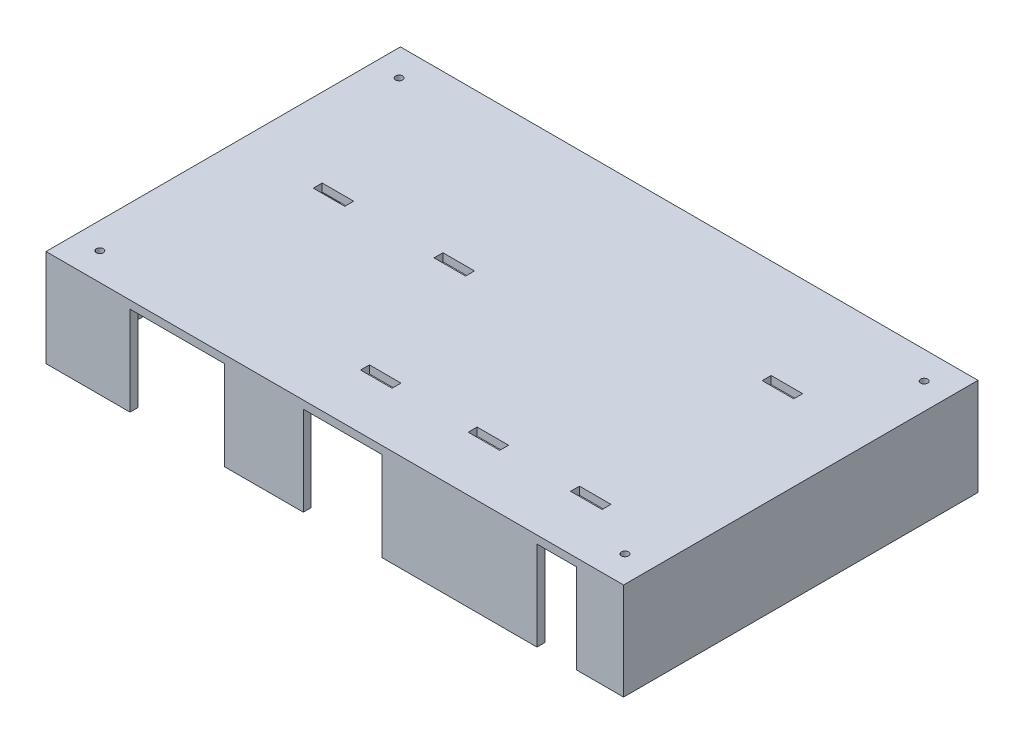
from build123d import *

# Parameters (mm, degrees)
SKETCH_1_W                     = 220
SKETCH_1_H                     = 135
BASE_FLOOR_3MM_DEPTH           = 3
SKETCH_2_W                     = 220
SKETCH_2_H                     = 3
BACK_WALL_DEPTH                = 37
SKETCH_3_W                     = 3
SKETCH_3_H                     = 132
LEFT_WALL_DEPTH                = 37
SKETCH_4_W                     = 3
SKETCH_4_H                     = 132
RIGHT_WALL_DEPTH               = 37
SKETCH_5_W                     = 32
SKETCH_5_H                     = 3
FRONT_LEFT_WALL_DEPTH          = 37
SKETCH_6_W                     = 30
SKETCH_6_H                     = 3
FRONT_CAMERA_BRIDGE_DEPTH      = 37
SKETCH_7_W                     = 59
SKETCH_7_H                     = 3
FRONT_SR04_BRIDGE_DEPTH        = 37
SKETCH_8_W                     = 18
SKETCH_8_H                     = 3
FRONT_RIGHT_WALL_DEPTH         = 37
SKETCH_9_R                     = 5
LID_BOSS_1_DEPTH               = 30
SKETCH_10_R                    = 1.35
LID_BOSS_1_PILOT_DEPTH         = 34
SKETCH_11_R                    = 5
LID_BOSS_2_DEPTH               = 30
SKETCH_12_R                    = 1.35
LID_BOSS_2_PILOT_DEPTH         = 34
SKETCH_13_R                    = 5
LID_BOSS_3_DEPTH               = 30
SKETCH_14_R                    = 1.35
LID_BOSS_3_PILOT_DEPTH         = 34
SKETCH_15_R                    = 5
LID_BOSS_4_DEPTH               = 30
SKETCH_16_R                    = 1.35
LID_BOSS_4_PILOT_DEPTH         = 34
SKETCH_17_R                    = 1.6
P4_NANO_PEG_1_DEPTH            = 7
SKETCH_18_R                    = 1.6
P4_NANO_PEG_2_DEPTH            = 7
SKETCH_19_R                    = 1.6
P4_NANO_PEG_3_DEPTH            = 7
SKETCH_20_R                    = 1.6
P4_NANO_PEG_4_DEPTH            = 7
SKETCH_21_R                    = 1.6
MEGA_PEG_1_DEPTH               = 7
SKETCH_22_R                    = 1.6
MEGA_PEG_2_DEPTH               = 7
SKETCH_23_R                    = 1.6
MEGA_PEG_3_DEPTH               = 7
SKETCH_24_R                    = 1.6
MEGA_PEG_4_DEPTH               = 7
SKETCH_25_W                    = 12
SKETCH_25_H                    = 3.4
CABLE_TIE_SLOT_1_DEPTH         = 4
SKETCH_26_W                    = 12
SKETCH_26_H                    = 3.4
CABLE_TIE_SLOT_2_DEPTH         = 4
SKETCH_27_W                    = 12
SKETCH_27_H                    = 3.4
CABLE_TIE_SLOT_3_DEPTH         = 4
SKETCH_28_W                    = 12
SKETCH_28_H                    = 3.4
CABLE_TIE_SLOT_4_DEPTH         = 4
SKETCH_29_W                    = 12
SKETCH_29_H                    = 3.4
CABLE_TIE_SLOT_5_DEPTH         = 4
SKETCH_30_W                    = 12
SKETCH_30_H                    = 3.4
CABLE_TIE_SLOT_6_DEPTH         = 4
SKETCH_31_W                    = 67
SKETCH_31_H                    = 3
ADJUSTABLE_SENSOR_RAIL_1_DEPTH = 4
SKETCH_32_W                    = 67
SKETCH_32_H                    = 3
ADJUSTABLE_SENSOR_RAIL_2_DEPTH = 4


with BuildPart() as part:
    # 草图1 → Base_Floor_3mm (new body)
    with BuildSketch(Plane(origin=(0, 0, 0), x_dir=(1, 0, 0), z_dir=(0, 1, 0))):
        Rectangle(SKETCH_1_W, SKETCH_1_H)
    extrude(amount=-BASE_FLOOR_3MM_DEPTH)

    # 草图2 → Back_Wall (add)
    with BuildSketch(Plane(origin=(0, 0, 0), x_dir=(1, 0, 0), z_dir=(0, 1, 0))):
        with Locations((0, 66)):
            Rectangle(SKETCH_2_W, SKETCH_2_H)
    extrude(amount=-BACK_WALL_DEPTH)

    # 草图3 → Left_Wall (add)
    with BuildSketch(Plane(origin=(0, 0, 0), x_dir=(1, 0, 0), z_dir=(0, 1, 0))):
        with Locations((-108.5, -1.5)):
            Rectangle(SKETCH_3_W, SKETCH_3_H)
    extrude(amount=-LEFT_WALL_DEPTH)

    # 草图4 → Right_Wall (add)
    with BuildSketch(Plane(origin=(0, 0, 0), x_dir=(1, 0, 0), z_dir=(0, 1, 0))):
        with Locations((108.5, -1.5)):
            Rectangle(SKETCH_4_W, SKETCH_4_H)
    extrude(amount=-RIGHT_WALL_DEPTH)

    # 草图5 → Front_Left_Wall (add)
    with BuildSketch(Plane(origin=(0, 0, 0), x_dir=(1, 0, 0), z_dir=(0, 1, 0))):
        with Locations((-94, -66)):
            Rectangle(SKETCH_5_W, SKETCH_5_H)
    extrude(amount=-FRONT_LEFT_WALL_DEPTH)

    # 草图6 → Front_Camera_Bridge (add)
    with BuildSketch(Plane(origin=(0, 0, 0), x_dir=(1, 0, 0), z_dir=(0, 1, 0))):
        with Locations((-27, -66)):
            Rectangle(SKETCH_6_W, SKETCH_6_H)
    extrude(amount=-FRONT_CAMERA_BRIDGE_DEPTH)

    # 草图7 → Front_SR04_Bridge (add)
    with BuildSketch(Plane(origin=(0, 0, 0), x_dir=(1, 0, 0), z_dir=(0, 1, 0))):
        with Locations((47.5, -66)):
            Rectangle(SKETCH_7_W, SKETCH_7_H)
    extrude(amount=-FRONT_SR04_BRIDGE_DEPTH)

    # 草图8 → Front_Right_Wall (add)
    with BuildSketch(Plane(origin=(0, 0, 0), x_dir=(1, 0, 0), z_dir=(0, 1, 0))):
        with Locations((101, -66)):
            Rectangle(SKETCH_8_W, SKETCH_8_H)
    extrude(amount=-FRONT_RIGHT_WALL_DEPTH)

    # 草图9 → Lid_Boss_1 (add)
    with BuildSketch(Plane(origin=(0, 0, 0), x_dir=(1, 0, 0), z_dir=(0, 1, 0))):
        with Locations(Location((-100, -57, 0), (0, 0, 270))):
            Circle(SKETCH_9_R)
    extrude(amount=-LID_BOSS_1_DEPTH)

    # 草图10 → Lid_Boss_1_Pilot (cut)
    with BuildSketch(Plane(origin=(0, 0, 0), x_dir=(1, 0, 0), z_dir=(0, 1, 0))):
        with Locations(Location((-100, -57, 0), (0, 0, 270))):
            Circle(SKETCH_10_R)
    extrude(amount=-LID_BOSS_1_PILOT_DEPTH, mode=Mode.SUBTRACT)

    # 草图11 → Lid_Boss_2 (add)
    with BuildSketch(Plane(origin=(0, 0, 0), x_dir=(1, 0, 0), z_dir=(0, 1, 0))):
        with Locations(Location((100, -57, 0), (0, 0, 270))):
            Circle(SKETCH_11_R)
    extrude(amount=-LID_BOSS_2_DEPTH)

    # 草图12 → Lid_Boss_2_Pilot (cut)
    with BuildSketch(Plane(origin=(0, 0, 0), x_dir=(1, 0, 0), z_dir=(0, 1, 0))):
        with Locations(Location((100, -57, 0), (0, 0, 270))):
            Circle(SKETCH_12_R)
    extrude(amount=-LID_BOSS_2_PILOT_DEPTH, mode=Mode.SUBTRACT)

    # 草图13 → Lid_Boss_3 (add)
    with BuildSketch(Plane(origin=(0, 0, 0), x_dir=(1, 0, 0), z_dir=(0, 1, 0))):
        with Locations(Location((-100, 57, 0), (0, 0, 270))):
            Circle(SKETCH_13_R)
    extrude(amount=-LID_BOSS_3_DEPTH)

    # 草图14 → Lid_Boss_3_Pilot (cut)
    with BuildSketch(Plane(origin=(0, 0, 0), x_dir=(1, 0, 0), z_dir=(0, 1, 0))):
        with Locations(Location((-100, 57, 0), (0, 0, 270))):
            Circle(SKETCH_14_R)
    extrude(amount=-LID_BOSS_3_PILOT_DEPTH, mode=Mode.SUBTRACT)

    # 草图15 → Lid_Boss_4 (add)
    with BuildSketch(Plane(origin=(0, 0, 0), x_dir=(1, 0, 0), z_dir=(0, 1, 0))):
        with Locations(Location((100, 57, 0), (0, 0, 270))):
            Circle(SKETCH_15_R)
    extrude(amount=-LID_BOSS_4_DEPTH)

    # 草图16 → Lid_Boss_4_Pilot (cut)
    with BuildSketch(Plane(origin=(0, 0, 0), x_dir=(1, 0, 0), z_dir=(0, 1, 0))):
        with Locations(Location((100, 57, 0), (0, 0, 270))):
            Circle(SKETCH_16_R)
    extrude(amount=-LID_BOSS_4_PILOT_DEPTH, mode=Mode.SUBTRACT)

    # 草图17 → P4_NANO_Peg_1 (add)
    with BuildSketch(Plane(origin=(0, 0, 0), x_dir=(1, 0, 0), z_dir=(0, 1, 0))):
        with Locations(Location((-93, 18, 0), (0, 0, 270))):
            Circle(SKETCH_17_R)
    extrude(amount=-P4_NANO_PEG_1_DEPTH)

    # 草图18 → P4_NANO_Peg_2 (add)
    with BuildSketch(Plane(origin=(0, 0, 0), x_dir=(1, 0, 0), z_dir=(0, 1, 0))):
        with Locations(Location((-48, 18, 0), (0, 0, 270))):
            Circle(SKETCH_18_R)
    extrude(amount=-P4_NANO_PEG_2_DEPTH)

    # 草图19 → P4_NANO_Peg_3 (add)
    with BuildSketch(Plane(origin=(0, 0, 0), x_dir=(1, 0, 0), z_dir=(0, 1, 0))):
        with Locations((-93, 63)):
            Circle(SKETCH_19_R)
    extrude(amount=-P4_NANO_PEG_3_DEPTH)

    # 草图20 → P4_NANO_Peg_4 (add)
    with BuildSketch(Plane(origin=(0, 0, 0), x_dir=(1, 0, 0), z_dir=(0, 1, 0))):
        with Locations((-48, 63)):
            Circle(SKETCH_20_R)
    extrude(amount=-P4_NANO_PEG_4_DEPTH)

    # 草图21 → Mega_Peg_1 (add)
    with BuildSketch(Plane(origin=(0, 0, 0), x_dir=(1, 0, 0), z_dir=(0, 1, 0))):
        with Locations(Location((0, -30, 0), (0, 0, 270))):
            Circle(SKETCH_21_R)
    extrude(amount=-MEGA_PEG_1_DEPTH)

    # 草图22 → Mega_Peg_2 (add)
    with BuildSketch(Plane(origin=(0, 0, 0), x_dir=(1, 0, 0), z_dir=(0, 1, 0))):
        with Locations(Location((96, -30, 0), (0, 0, 270))):
            Circle(SKETCH_22_R)
    extrude(amount=-MEGA_PEG_2_DEPTH)

    # 草图23 → Mega_Peg_3 (add)
    with BuildSketch(Plane(origin=(0, 0, 0), x_dir=(1, 0, 0), z_dir=(0, 1, 0))):
        with Locations(Location((0, 12, 0), (0, 0, 270))):
            Circle(SKETCH_23_R)
    extrude(amount=-MEGA_PEG_3_DEPTH)

    # 草图24 → Mega_Peg_4 (add)
    with BuildSketch(Plane(origin=(0, 0, 0), x_dir=(1, 0, 0), z_dir=(0, 1, 0))):
        with Locations(Location((96, 12, 0), (0, 0, 270))):
            Circle(SKETCH_24_R)
    extrude(amount=-MEGA_PEG_4_DEPTH)

    # 草图25 → Cable_Tie_Slot_1 (cut)
    with BuildSketch(Plane(origin=(0, 0, 0), x_dir=(1, 0, 0), z_dir=(0, 1, 0))):
        with Locations((-74, 6)):
            Rectangle(SKETCH_25_W, SKETCH_25_H)
    extrude(amount=-CABLE_TIE_SLOT_1_DEPTH, mode=Mode.SUBTRACT)

    # 草图26 → Cable_Tie_Slot_2 (cut)
    with BuildSketch(Plane(origin=(0, 0, 0), x_dir=(1, 0, 0), z_dir=(0, 1, 0))):
        with Locations((-28, 6)):
            Rectangle(SKETCH_26_W, SKETCH_26_H)
    extrude(amount=-CABLE_TIE_SLOT_2_DEPTH, mode=Mode.SUBTRACT)

    # 草图27 → Cable_Tie_Slot_3 (cut)
    with BuildSketch(Plane(origin=(0, 0, 0), x_dir=(1, 0, 0), z_dir=(0, 1, 0))):
        with Locations((-5, -45)):
            Rectangle(SKETCH_27_W, SKETCH_27_H)
    extrude(amount=-CABLE_TIE_SLOT_3_DEPTH, mode=Mode.SUBTRACT)

    # 草图28 → Cable_Tie_Slot_4 (cut)
    with BuildSketch(Plane(origin=(0, 0, 0), x_dir=(1, 0, 0), z_dir=(0, 1, 0))):
        with Locations((36, -45)):
            Rectangle(SKETCH_28_W, SKETCH_28_H)
    extrude(amount=-CABLE_TIE_SLOT_4_DEPTH, mode=Mode.SUBTRACT)

    # 草图29 → Cable_Tie_Slot_5 (cut)
    with BuildSketch(Plane(origin=(0, 0, 0), x_dir=(1, 0, 0), z_dir=(0, 1, 0))):
        with Locations((75, -45)):
            Rectangle(SKETCH_29_W, SKETCH_29_H)
    extrude(amount=-CABLE_TIE_SLOT_5_DEPTH, mode=Mode.SUBTRACT)

    # 草图30 → Cable_Tie_Slot_6 (cut)
    with BuildSketch(Plane(origin=(0, 0, 0), x_dir=(1, 0, 0), z_dir=(0, 1, 0))):
        with Locations((75, 28)):
            Rectangle(SKETCH_30_W, SKETCH_30_H)
    extrude(amount=-CABLE_TIE_SLOT_6_DEPTH, mode=Mode.SUBTRACT)

    # 草图31 → Adjustable_Sensor_Rail_1 (add)
    with BuildSketch(Plane(origin=(0, 0, 0), x_dir=(1, 0, 0), z_dir=(0, 1, 0))):
        with Locations((61.5, 32.5)):
            Rectangle(SKETCH_31_W, SKETCH_31_H)
    extrude(amount=-ADJUSTABLE_SENSOR_RAIL_1_DEPTH)

    # 草图32 → Adjustable_Sensor_Rail_2 (add)
    with BuildSketch(Plane(origin=(0, 0, 0), x_dir=(1, 0, 0), z_dir=(0, 1, 0))):
        with Locations((61.5, 50.5)):
            Rectangle(SKETCH_32_W, SKETCH_32_H)
    extrude(amount=-ADJUSTABLE_SENSOR_RAIL_2_DEPTH)


solid = part.part
